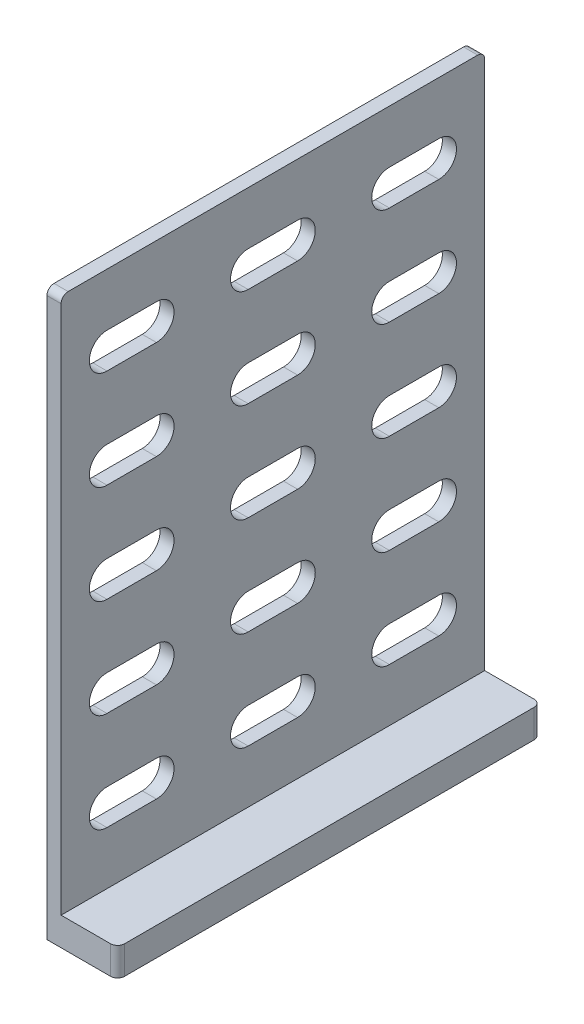
from build123d import *

# Parameters (mm, degrees)
P_IDAT_VYSUNUT_M1_DEPTH  = 30
ODEBRAT_VYSUNUT_M1_DEPTH = 86.813751812
LINPOLE1_COUNT           = 3
LINPOLE1_PITCH           = 20
LINPOLE1_COUNT_DIR2      = 6
LINPOLE1_PITCH_DIR2      = 14
ZAOBLIT1_R               = 1


with BuildPart() as part:
    # Skica1 → Přidat vysunutím1 (new, symmetric)
    with BuildSketch(Plane.XY):
        Polygon((10, 0), (0, 0), (0, 80), (2, 80), (2, 4), (10, 4), align=None)
    extrude(amount=P_IDAT_VYSUNUT_M1_DEPTH, both=True)

    # Skica2 → Odebrat vysunutím1 (cut, through all)
    with BuildSketch(Plane(origin=(2, 0, 0), x_dir=(0, 0, -1), z_dir=(1, 0, 0))):
        with BuildLine():
            Line((-23.5, 16.5), (-16.5, 16.5))
            ThreePointArc((-16.5, 16.5), (-14, 14), (-16.5, 11.5))
            Line((-16.5, 11.5), (-23.5, 11.5))
            ThreePointArc((-23.5, 11.5), (-26, 14), (-23.5, 16.5))
        make_face()
    odebrat_vysunut_m1 = extrude(amount=-ODEBRAT_VYSUNUT_M1_DEPTH, mode=Mode.SUBTRACT)

    # LinPole1: Odebrat vysunut_m1 3 × 6
    with Locations(*[(0, j * LINPOLE1_PITCH_DIR2, -i * LINPOLE1_PITCH) for i in range(LINPOLE1_COUNT) for j in range(LINPOLE1_COUNT_DIR2) if (i, j) != (0, 0)]):
        add(odebrat_vysunut_m1, mode=Mode.SUBTRACT)

    # Zaoblit1
    zaoblit1_edges = [part.edges().sort_by_distance(p)[0] for p in [
        (1, 80, 30),
        (10, 2, 30),
        (1, 80, -30),
        (10, 2, -30),
    ]]
    fillet(zaoblit1_edges, radius=ZAOBLIT1_R)


solid = part.part
